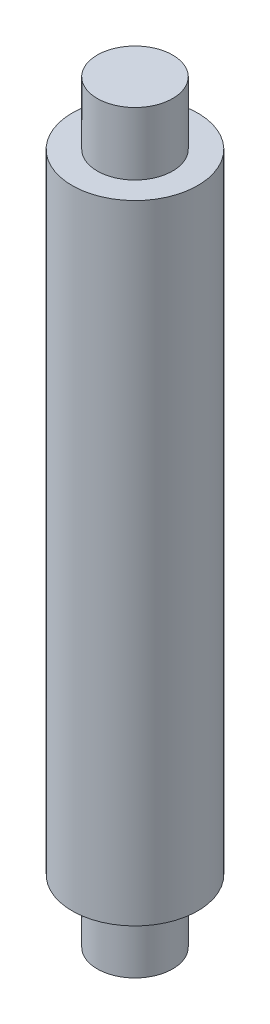
from build123d import *


with BuildPart() as part:
    # Croquis1 → Revolución1 (revolve)
    with BuildSketch(Plane.XY):
        Polygon((0, 0), (-6, 0), (-6, 10), (-10, 10), (-10, 110), (-6, 110), (-6, 120), (0, 120), align=None)
    revolve(axis=Axis((0, 120, 0), (0, -1, 0)))


solid = part.part
